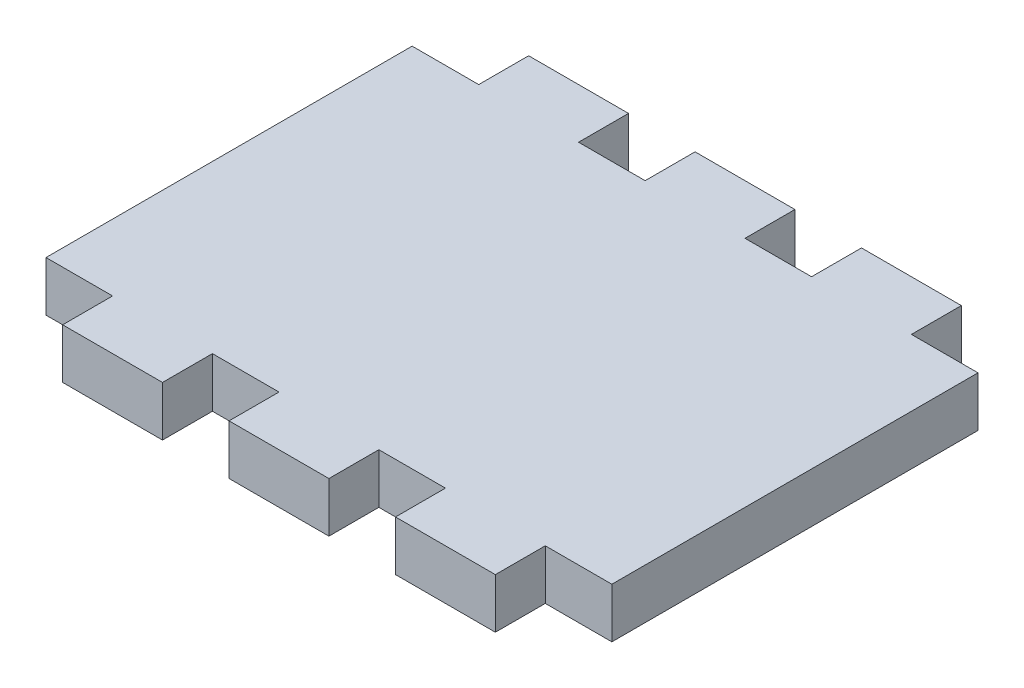
from build123d import *

# Parameters (mm, degrees)
SKETCH1_W            = 34
SKETCH1_H            = 28
BOSS_EXTRUDE1_DEPTH  = 3
SKETCH2_W            = 4
SKETCH2_H            = 3
CUT_EXTRUDE1_DEPTH   = 3
LPATTERN1_COUNT      = 4
LPATTERN1_PITCH      = 10
LPATTERN1_COUNT_DIR2 = 2
LPATTERN1_PITCH_DIR2 = 25


with BuildPart() as part:
    # Sketch1 → Boss-Extrude1 (new body)
    with BuildSketch(Plane(origin=(0, 0, 0), x_dir=(1, 0, 0), z_dir=(0, 1, 0))):
        Rectangle(SKETCH1_W, SKETCH1_H)
    extrude(amount=BOSS_EXTRUDE1_DEPTH)

    # Sketch2 → Cut-Extrude1 (cut)
    with BuildSketch(Plane(origin=(0, 3, 0), x_dir=(1, 0, 0), z_dir=(0, 1, 0))):
        with Locations((-15, 12.5)):
            Rectangle(SKETCH2_W, SKETCH2_H)
    cut_extrude1 = extrude(amount=-CUT_EXTRUDE1_DEPTH, mode=Mode.SUBTRACT)

    # LPattern1: Cut-Extrude1 4 × 2
    with Locations(*[(i * LPATTERN1_PITCH, 0, j * LPATTERN1_PITCH_DIR2) for i in range(LPATTERN1_COUNT) for j in range(LPATTERN1_COUNT_DIR2) if (i, j) != (0, 0)]):
        add(cut_extrude1, mode=Mode.SUBTRACT)


solid = part.part
